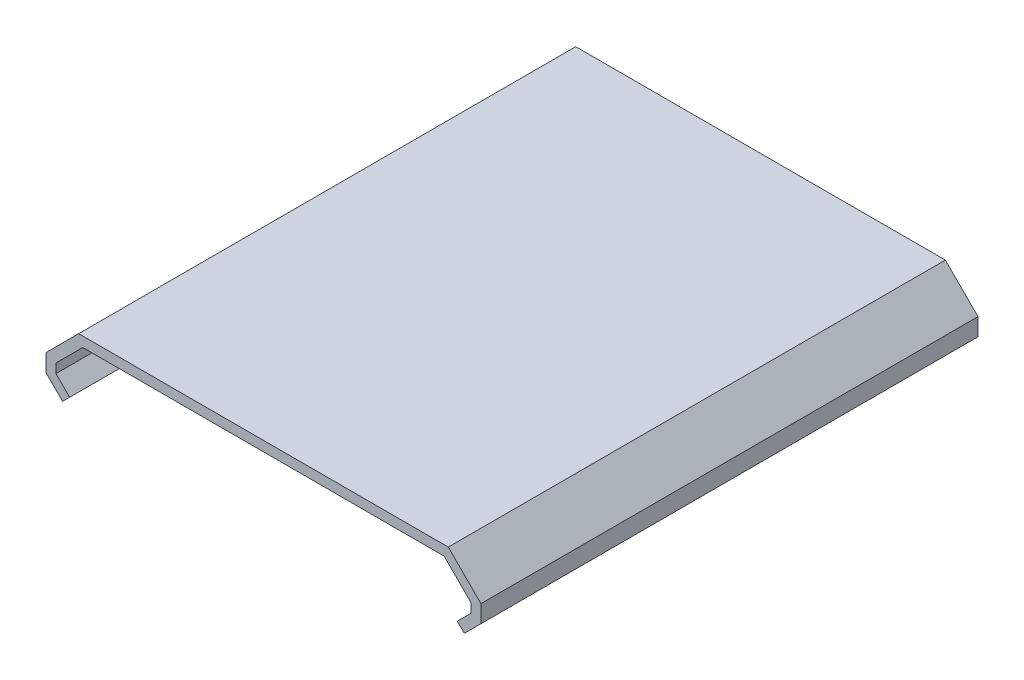
from build123d import *

# Parameters (mm, degrees)
EXTRUDE_1_DEPTH   = 200
EXTRUDE_1_2_DEPTH = 17


with BuildPart() as part:
    # 草图1 → Extrude 1 (new body)
    with BuildSketch(Plane.XY):
        Polygon((78, 32), (83.5, 37.5), (83.5, 41.207106781), (72.707106781, 52), (-72.707106781, 52), (-83.5, 41.207106781), (-83.5, 37.5), (-78, 32), (-80.828427125, 29.171572875), (-87.5, 35.843145751), (-87.5, 42.863961031), (-74.363961031, 56), (74.363961031, 56), (87.5, 42.863961031), (87.5, 35.843145751), (80.828427125, 29.171572875), align=None)
    extrude(amount=-EXTRUDE_1_DEPTH)

    # 草图2 → Extrude 1 2 (add)
    with BuildSketch(Plane(origin=(0, 0, -200), x_dir=(-1, 0, 0), z_dir=(0, 0, -1))):
        Polygon((-7.989949494, 52), (3, 52), (3, 41.010050506), align=None)
    extrude(amount=-EXTRUDE_1_2_DEPTH)


solid = part.part
